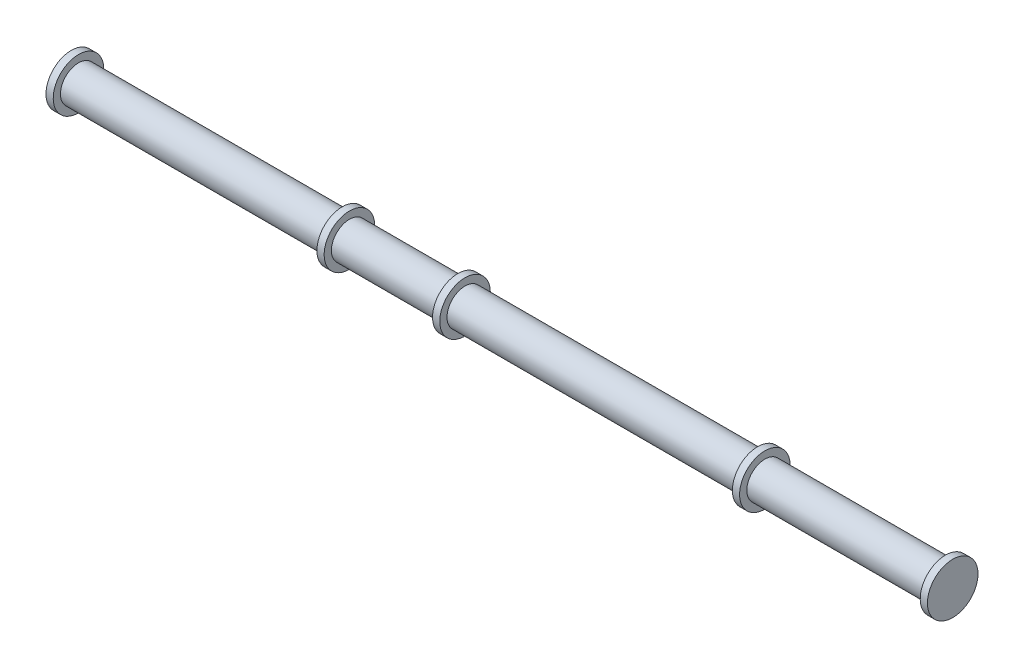
from build123d import *


with BuildPart() as part:
    # Sketch2 → Revolve1 (revolve)
    with BuildSketch(Plane.XY):
        Polygon((0, 0), (0, 7), (2, 7), (2, 5), (32, 5), (75, 5), (75, 7), (77, 7), (77, 5), (107, 5), (107, 7), (109, 7), (109, 5), (190, 5), (190, 7), (192, 7), (192, 5), (242, 5), (242, 7), (244, 7), (244, 5), (244, 0), align=None)
    revolve(axis=Axis((244, 0, 0), (-1, 0, 0)))


solid = part.part
